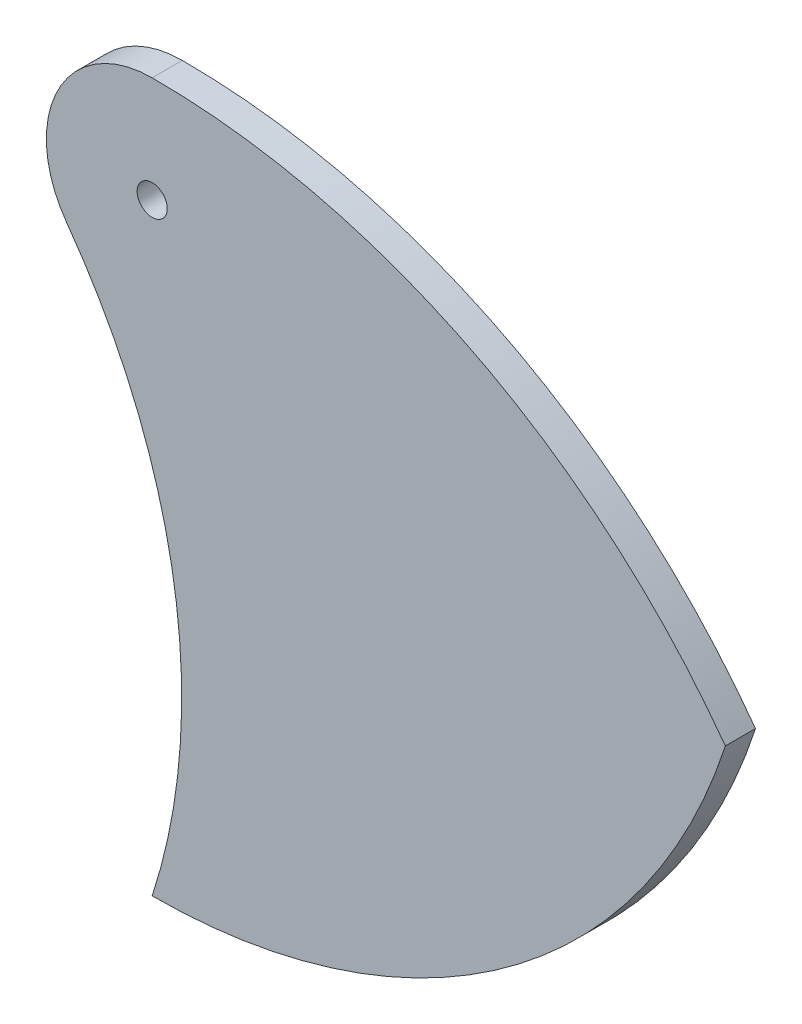
from build123d import *

# Parameters (mm, degrees)
SKETCH1_R           = 0.75
BOSS_EXTRUDE1_DEPTH = 1.5


with BuildPart() as part:
    # Sketch1 → Boss-Extrude1 (new body)
    with BuildSketch(Plane.XY):
        with BuildLine():
            ThreePointArc((0, 35.267115138), (16.010935226, 31.423229677), (28.531695489, 20.729490169))
            ThreePointArc((28.531695489, 20.729490169), (17.633557569, 5.729490169), (0, 0))
            ThreePointArc((0, 0), (1.098954729, 13.963543782), (-4.261185658, 26.9040674))
            ThreePointArc((-4.261185658, 26.9040674), (-4.693033951, 32.391220233), (0, 35.267115138))
        make_face()
        with Locations((0, 30)):
            Circle(SKETCH1_R, mode=Mode.SUBTRACT)
    extrude(amount=BOSS_EXTRUDE1_DEPTH)


solid = part.part
